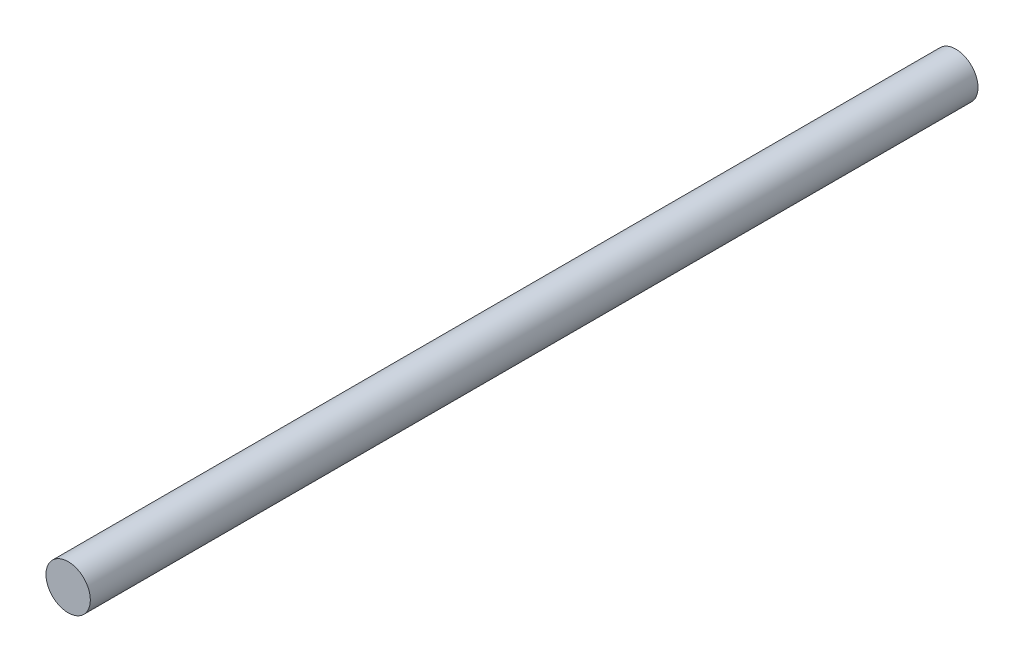
from build123d import *

# Parameters (mm, degrees)
SKETCH_1_W = 4
SKETCH_1_H = 160


with BuildPart() as part:
    # Эскиз1 → Повернуть1 (revolve)
    with BuildSketch(Plane(origin=(0, 0, 0), x_dir=(1, 0, 0), z_dir=(0, 1, 0))):
        with Locations((2, -80)):
            Rectangle(SKETCH_1_W, SKETCH_1_H)
    revolve(axis=Axis((0, 0, 0), (0, 0, 1)))


solid = part.part
